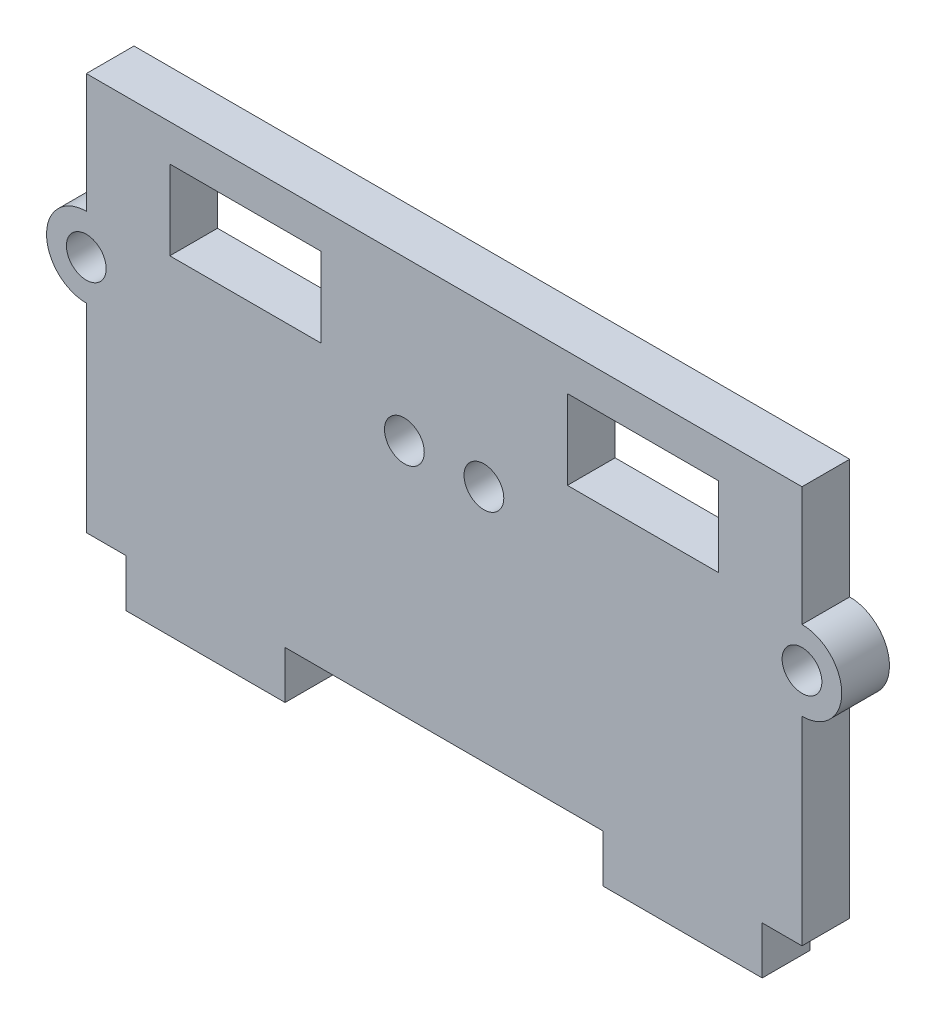
from build123d import *

# Parameters (mm, degrees)
CROQUIS1_W              = 25
CROQUIS1_H              = 28
CROQUIS1_R              = 1.25
CROQUIS1_W_2            = 9.5
CROQUIS1_H_2            = 5
SALIENTE_EXTRUIR1_DEPTH = 1.5
CROQUIS4_W              = 20
CROQUIS4_H              = 3
CORTAR_EXTRUIR5_DEPTH   = 10


with BuildPart() as part:
    # Croquis1 → Saliente-Extruir1 (new, symmetric)
    # profile 1 of 2: a face of its own
    with BuildSketch(Plane.XY):
        Rectangle(CROQUIS1_W, CROQUIS1_H)
        with Locations((-10, 4)):
            Circle(CROQUIS1_R, mode=Mode.SUBTRACT)
        with Locations((10, 4)):
            Circle(CROQUIS1_R, mode=Mode.SUBTRACT)
        with Locations((0, 9.2)):
            Rectangle(CROQUIS1_W_2, CROQUIS1_H_2, mode=Mode.SUBTRACT)
    # profile 2 of 2: a face of its own
    with BuildSketch(Plane.XY):
        with Locations((25, 0)):
            Rectangle(CROQUIS1_W, CROQUIS1_H)
        with Locations((15, 4)):
            Circle(CROQUIS1_R, mode=Mode.SUBTRACT)
        with Locations((35, 4)):
            Circle(CROQUIS1_R, mode=Mode.SUBTRACT)
        with Locations((25, 9.2)):
            Rectangle(CROQUIS1_W_2, CROQUIS1_H_2, mode=Mode.SUBTRACT)
    extrude(amount=SALIENTE_EXTRUIR1_DEPTH, both=True)

    # Croquis4 → Cortar-Extruir5 (cut)
    with BuildSketch(Plane.XY.offset(1.5)):
        with BuildLine():
            Line((-10, 6.5), (-10, 14))
            Line((-10, 14), (-12.5, 14))
            Line((-12.5, 14), (-12.5, 4))
            ThreePointArc((-12.5, 4), (-11.767766953, 5.767766953), (-10, 6.5))
        make_face()
        with BuildLine():
            Line((-10, -11), (-10, 1.5))
            ThreePointArc((-10, 1.5), (-11.767766953, 2.232233047), (-12.5, 4))
            Line((-12.5, 4), (-12.5, -14))
            Line((-12.5, -14), (-7.5, -14))
            Line((-7.5, -14), (-7.5, -11))
            Line((-7.5, -11), (-10, -11))
        make_face()
        with Locations((12.5, -12.5)):
            Rectangle(CROQUIS4_W, CROQUIS4_H)
        with BuildLine():
            Line((37.5, -14), (37.5, 4))
            ThreePointArc((37.5, 4), (36.767766953, 2.232233047), (35, 1.5))
            Line((35, 1.5), (35, -11))
            Line((35, -11), (32.5, -11))
            Line((32.5, -11), (32.5, -14))
            Line((32.5, -14), (37.5, -14))
        make_face()
        with BuildLine():
            Line((37.5, 14), (35, 14))
            Line((35, 14), (35, 6.5))
            ThreePointArc((35, 6.5), (36.767766953, 5.767766953), (37.5, 4))
            Line((37.5, 4), (37.5, 14))
        make_face()
    extrude(amount=-CORTAR_EXTRUIR5_DEPTH, mode=Mode.SUBTRACT)


solid = part.part
